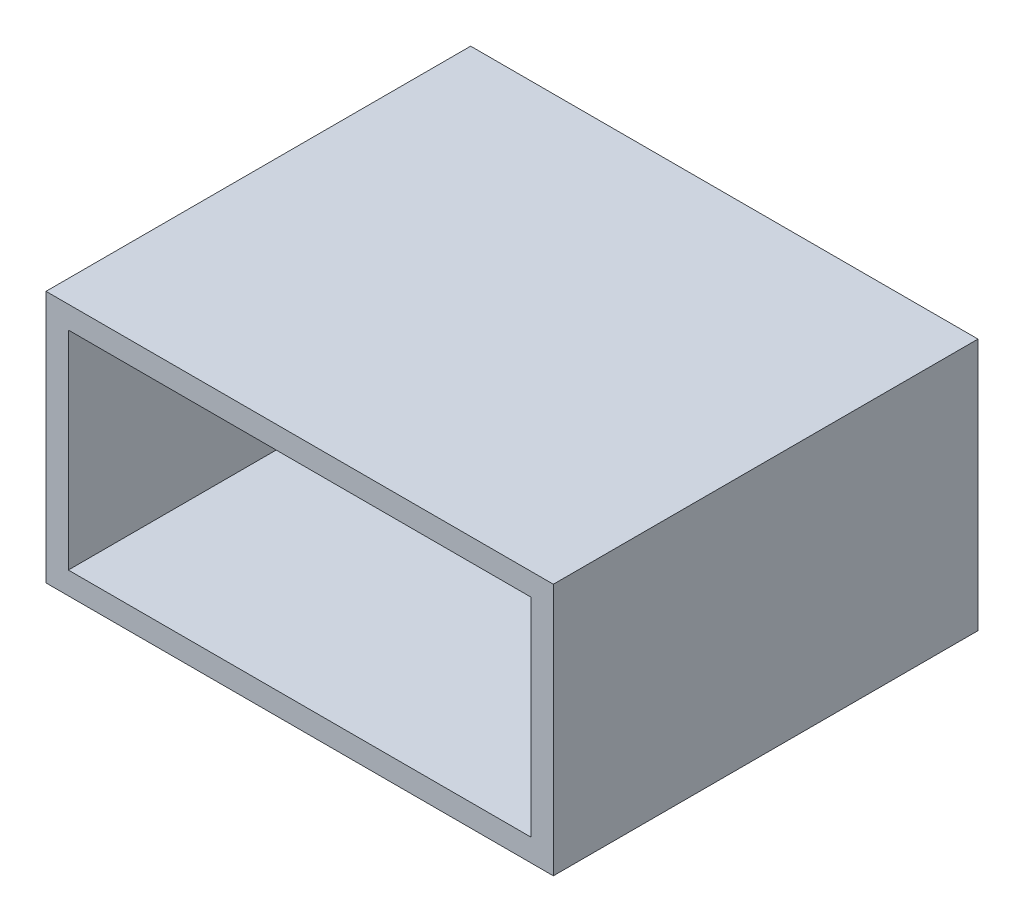
from build123d import *

# Parameters (mm, degrees)
SKETCH_1_W      = 11.35
SKETCH_1_H      = 5.65
SKETCH_1_W_2    = 10.35
SKETCH_1_H_2    = 4.65
EXTRUDE_1_DEPTH = 9.5
SCALE_1_SCALE   = 1.2


with BuildPart() as part:
    # 草图1 → 拉伸-薄壁1 (new body)
    with BuildSketch(Plane.XY):
        Rectangle(SKETCH_1_W, SKETCH_1_H)
        Rectangle(SKETCH_1_W_2, SKETCH_1_H_2, mode=Mode.SUBTRACT)
    extrude(amount=EXTRUDE_1_DEPTH)


with BuildPart() as part_1:
    # 缩放比例1: scaled about (0, 0, 4.75)
    add(part.part.scale(SCALE_1_SCALE).moved(Location((0, 0, -0.95))))


solid = part_1.part
